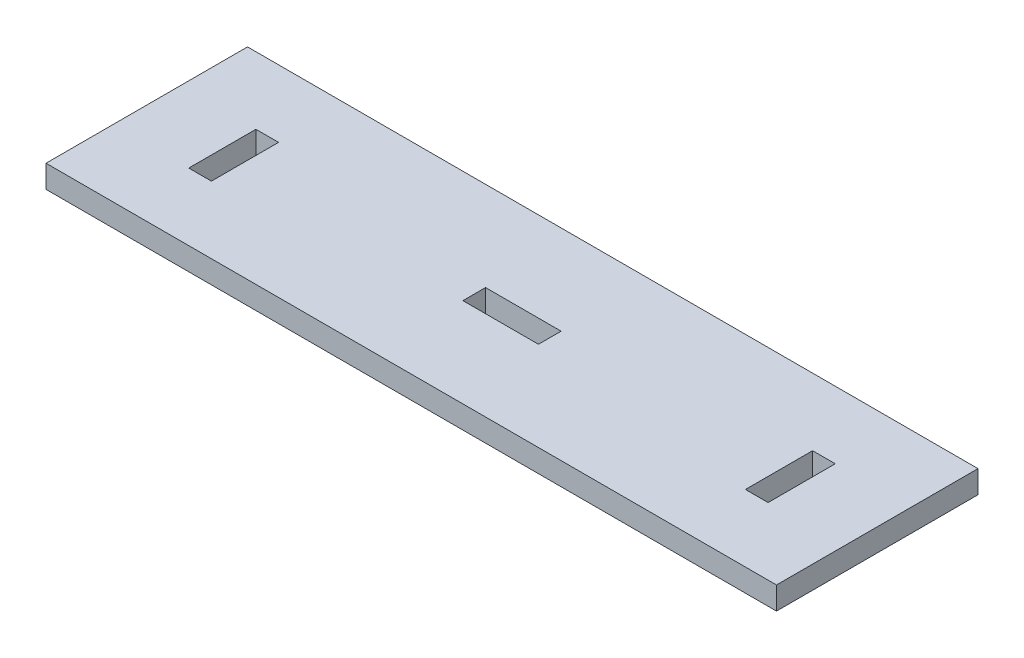
from build123d import *

# Parameters (mm, degrees)
SKETCH1_W           = 30
SKETCH1_H           = 9
SKETCH1_W_2         = 9
SKETCH1_H_2         = 26.666666667
BOSS_EXTRUDE1_DEPTH = 9


with BuildPart() as part:
    # Sketch1 → Boss-Extrude1 (new body)
    # profile 1 of 7: a face of its own
    with BuildSketch(Plane(origin=(0, 0, 0), x_dir=(1, 0, 0), z_dir=(0, 1, 0))):
        Polygon((39, 26.666666667), (39, 0), (251, 0), (251, 26.666666667), (251, 53.333333333), (251, 80), (39, 80), (39, 53.333333333), align=None)
        with Locations((145, 40)):
            Rectangle(SKETCH1_W, SKETCH1_H, mode=Mode.SUBTRACT)
    # profile 2 of 7: a face of its own
    with BuildSketch(Plane(origin=(0, 0, 0), x_dir=(1, 0, 0), z_dir=(0, 1, 0))):
        with Locations((34.5, 66.666666667)):
            Rectangle(SKETCH1_W_2, SKETCH1_H_2)
    # profile 3 of 7: a face of its own
    with BuildSketch(Plane(origin=(0, 0, 0), x_dir=(1, 0, 0), z_dir=(0, 1, 0))):
        with Locations((34.5, 13.333333334)):
            Rectangle(SKETCH1_W_2, SKETCH1_H_2)
    # profile 4 of 7: a face of its own
    with BuildSketch(Plane(origin=(0, 0, 0), x_dir=(1, 0, 0), z_dir=(0, 1, 0))):
        Polygon((0, 80), (0, 0), (30, 0), (30, 26.666666667), (30, 53.333333333), (30, 80), align=None)
    # profile 5 of 7: a face of its own
    with BuildSketch(Plane(origin=(0, 0, 0), x_dir=(1, 0, 0), z_dir=(0, 1, 0))):
        Polygon((260, 26.666666667), (260, 0), (290, 0), (290, 80), (260, 80), (260, 53.333333333), align=None)
    # profile 6 of 7: a face of its own
    with BuildSketch(Plane(origin=(0, 0, 0), x_dir=(1, 0, 0), z_dir=(0, 1, 0))):
        with Locations((255.5, 13.333333334)):
            Rectangle(SKETCH1_W_2, SKETCH1_H_2)
    # profile 7 of 7: a face of its own
    with BuildSketch(Plane(origin=(0, 0, 0), x_dir=(1, 0, 0), z_dir=(0, 1, 0))):
        with Locations((255.5, 66.666666667)):
            Rectangle(SKETCH1_W_2, SKETCH1_H_2)
    extrude(amount=BOSS_EXTRUDE1_DEPTH)


solid = part.part
